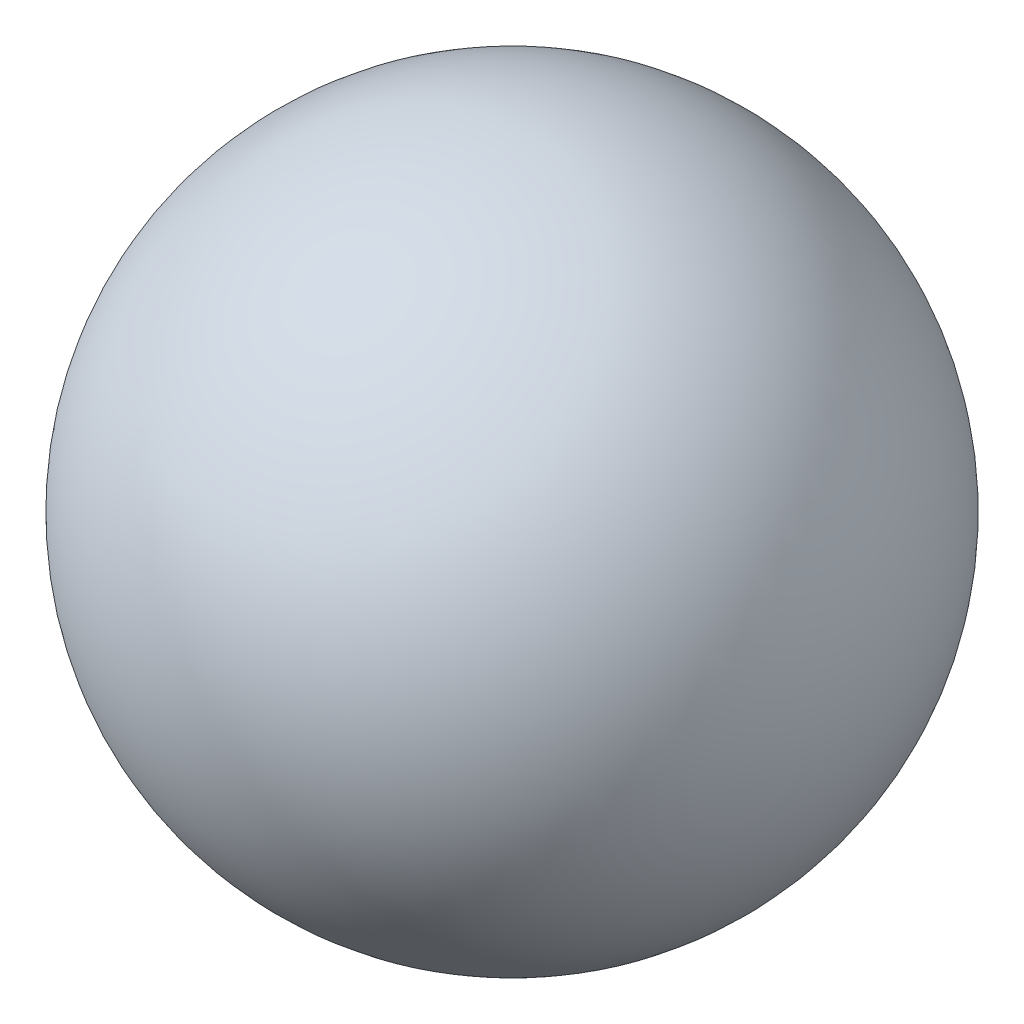
from build123d import *


with BuildPart() as part:
    # Sketch1 → Revolve1 (revolve)
    with BuildSketch(Plane.XY):
        with BuildLine():
            Line((0, 38.5), (0, -38.5))
            ThreePointArc((0, -38.5), (-38.5, 0), (0, 38.5))
        make_face()
    revolve(axis=Axis((0, 38.5, 0), (0, -1, 0)))


solid = part.part
